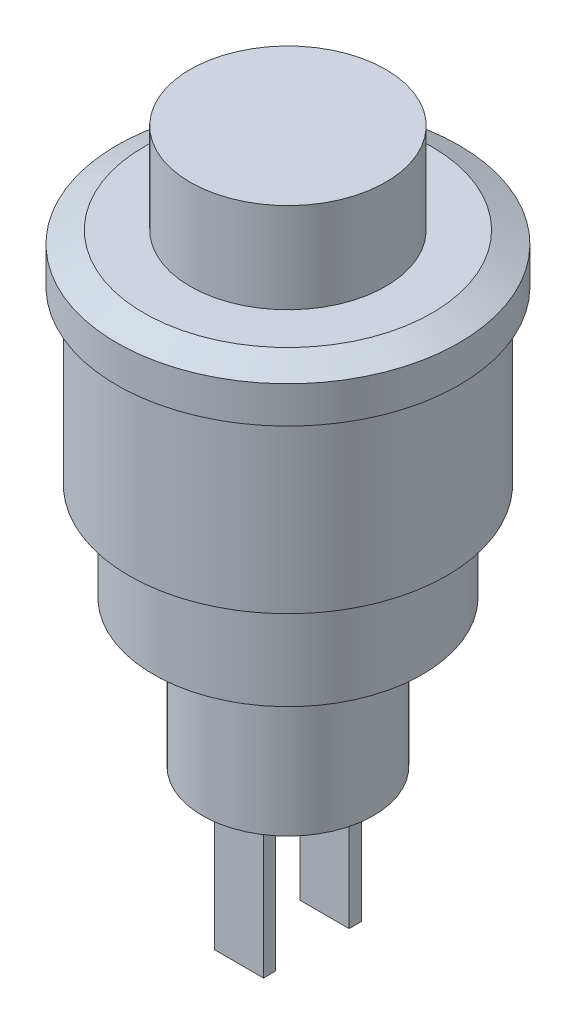
from build123d import *

# Parameters (mm, degrees)
ESBO_O2_W                = 2
ESBO_O2_H                = 0.5
RESSALTO_EXTRUS_O1_DEPTH = 6


with BuildPart() as part:
    # Esboço1 → Revolução1 (revolve)
    with BuildSketch(Plane.XY, mode=Mode.PRIVATE) as revolu_o1_sk:
        Polygon((0, 22.689764513), (4, 22.689764513), (4, 19), (5.891304348, 19), (7, 18.5), (7, 17), (6.5, 17), (6.5, 10), (5.5, 10), (5.5, 6), (3.5, 6), (3.5, 0), (0, 0), align=None)
    revolve(revolu_o1_sk.sketch.rotate(Axis((0, 0, 0), (0, 1, 0)), 90), axis=Axis((0, 0, 0), (0, 1, 0)))

    # Esboço2 → Ressalto-extrusão1 (add)
    with BuildSketch(Plane.XZ):
        with Locations((0, -1.75)):
            Rectangle(ESBO_O2_W, ESBO_O2_H)
        with Locations((0, 1.75)):
            Rectangle(ESBO_O2_W, ESBO_O2_H)
    extrude(amount=RESSALTO_EXTRUS_O1_DEPTH)


solid = part.part
